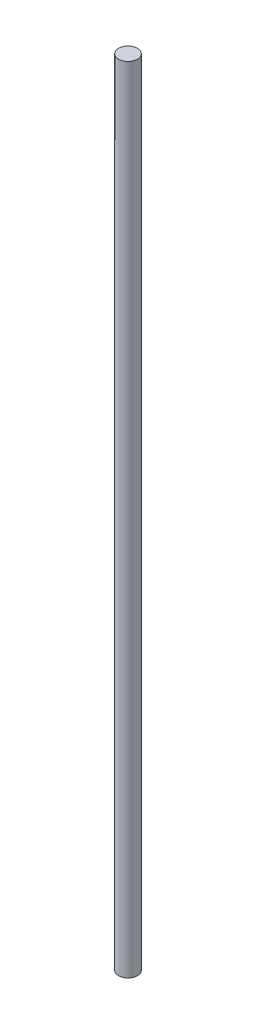
from build123d import *

# Parameters (mm, degrees)
ESQUISSE1_R        = 2.5
BOSS_EXTRU_1_DEPTH = 210


with BuildPart() as part:
    # Esquisse1 → Boss.-Extru.1 (new body)
    with BuildSketch(Plane(origin=(0, 0, 0), x_dir=(1, 0, 0), z_dir=(0, 1, 0))):
        with Locations(Location((0, 0, 0), (0, 0, 270))):
            Circle(ESQUISSE1_R)
    extrude(amount=BOSS_EXTRU_1_DEPTH)


solid = part.part
